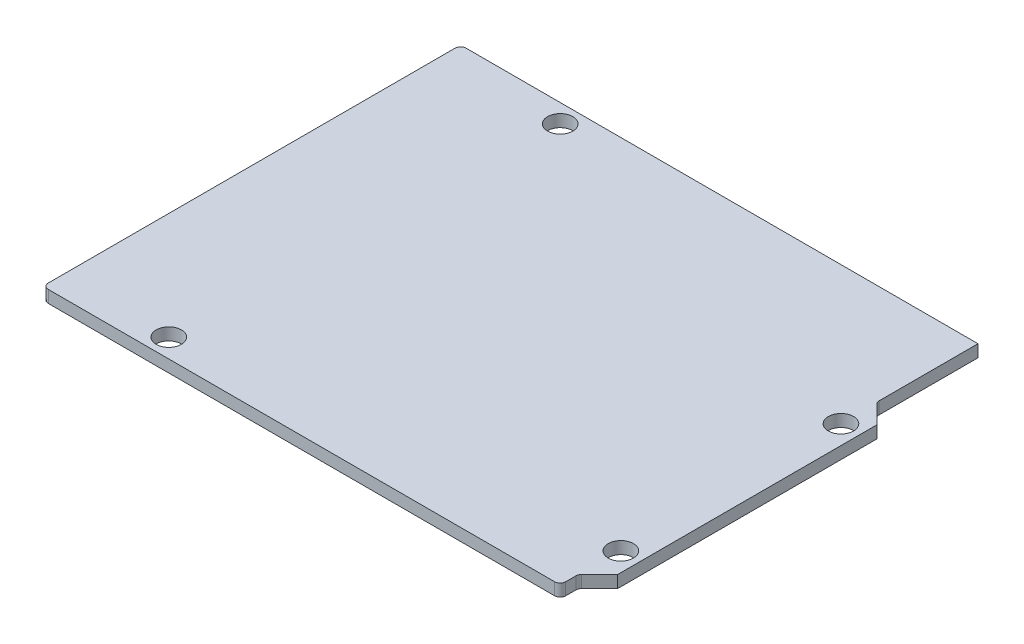
from build123d import *

# Parameters (mm, degrees)
ESQUISSE1_R        = 1.6
BOSS_EXTRU_1_DEPTH = 1.55
CONG_1_R           = 0.7


with BuildPart() as part:
    # Esquisse1 → Boss.-Extru.1 (new body)
    with BuildSketch(Plane(origin=(0, 0, 0), x_dir=(1, 0, 0), z_dir=(0, 1, 0))):
        Polygon((65.7, 53.05), (65.7, 40.2), (68.2, 37.7), (68.2, 4.8), (65.7, 2.3), (65.7, 0), (0, 0), (0, 53.05), align=None)
        with Locations(Location((15, 50.7, 0), (0, 0, 90))):
            Circle(ESQUISSE1_R, mode=Mode.SUBTRACT)
        with Locations(Location((13.6, 2.4, 0), (0, 0, 90))):
            Circle(ESQUISSE1_R, mode=Mode.SUBTRACT)
        with Locations(Location((65.8, 7.6, 0), (0, 0, 90))):
            Circle(ESQUISSE1_R, mode=Mode.SUBTRACT)
        with Locations(Location((65.8, 35.55, 0), (0, 0, 90))):
            Circle(ESQUISSE1_R, mode=Mode.SUBTRACT)
    extrude(amount=BOSS_EXTRU_1_DEPTH)

    # Congé1
    cong_1_edges = [part.edges().sort_by_distance(p)[0] for p in [
        (0, 0.775, -53.05),
        (65.7, 0.775, -40.2),
        (65.7, 0.775, -2.3),
        (65.7, 0.775, 0),
        (0, 0.775, 0),
    ]]
    fillet(cong_1_edges, radius=CONG_1_R)


solid = part.part
